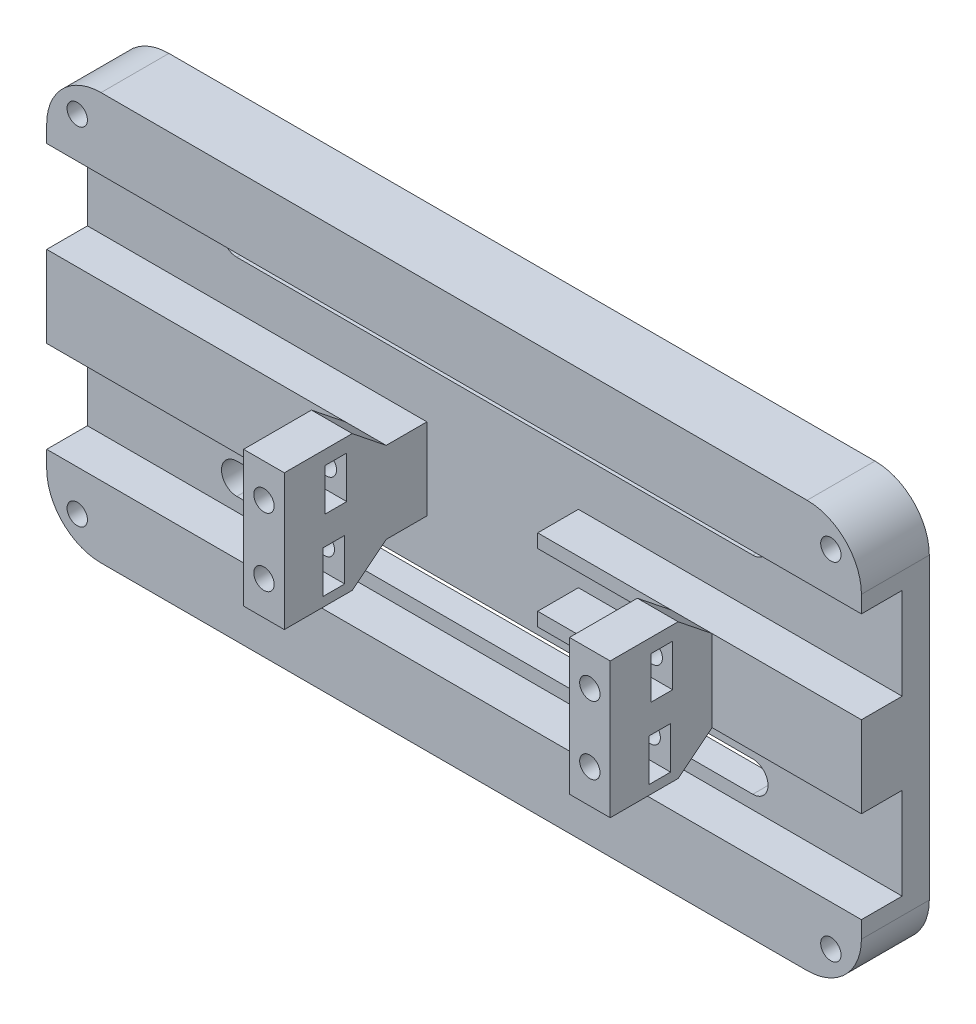
from build123d import *

# Parameters (mm, degrees)
SKETCH1_W             = 120
SKETCH1_H             = 10.5
SKETCH1_R             = 3
BOSS_EXTRUDE1_DEPTH   = 10
SKETCH1_W_2           = 44
SKETCH1_H_2           = 12
BOSS_EXTRUDE1_2_DEPTH = 10
SKETCH1_W_3           = 22
BOSS_EXTRUDE1_3_DEPTH = 10
BOSS_EXTRUDE1_4_DEPTH = 10
SKETCH1_H_3           = 2
BOSS_EXTRUDE1_5_DEPTH = 10
BOSS_EXTRUDE1_6_DEPTH = 10
SKETCH1_5_W           = 6
SKETCH1_5_H           = 20
BOSS_EXTRUDE2_DEPTH   = 25
BOSS_EXTRUDE3_DEPTH   = 4
SKETCH1_8_R           = 3
SKETCH1_8_R_2         = 1.5
BOSS_EXTRUDE4_DEPTH   = 10
SKETCH1_10_R          = 3
SKETCH1_10_R_2        = 1.5
CUT_EXTRUDE1_DEPTH    = 4
SKETCH3_R             = 1.5
CUT_EXTRUDE4_DEPTH    = 14
SKETCH4_R             = 1.5
CUT_EXTRUDE5_DEPTH    = 14
CUT_EXTRUDE6_DEPTH    = 59
SKETCH5_4_W           = 3.2
SKETCH5_4_H           = 6.2
CUT_EXTRUDE8_DEPTH    = 59
SKETCH1_11_R          = 1.5
CUT_EXTRUDE9_DEPTH    = 59
SKETCH6_W             = 2.316345527
SKETCH6_H             = 6
CUT_EXTRUDE10_DEPTH   = 13
FILLET1_R             = 8
SKETCH7_R             = 0.85
CUT_EXTRUDE13_DEPTH   = 6


with BuildPart() as part:
    # Sketch1 → Boss-Extrude1 (new body)
    with BuildSketch(Plane.XY):
        with Locations((0.319715808, 30.75)):
            Rectangle(SKETCH1_W, SKETCH1_H)
        with Locations((-55.180284192, 31.5)):
            Circle(SKETCH1_R, mode=Mode.SUBTRACT)
        with Locations((55.819715808, 31.5)):
            Circle(SKETCH1_R, mode=Mode.SUBTRACT)
    extrude(amount=BOSS_EXTRUDE1_DEPTH)



with BuildPart() as body_2:
    # Sketch1 → Boss-Extrude1 2 (new body)
    with BuildSketch(Plane.XY):
        with Locations((-37.680284192, 6)):
            Rectangle(SKETCH1_W_2, SKETCH1_H_2)
    extrude(amount=BOSS_EXTRUDE1_2_DEPTH)



with BuildPart() as body_3:
    # Sketch1 → Boss-Extrude1 3 (new body)
    with BuildSketch(Plane.XY):
        with Locations((49.319715808, 6)):
            Rectangle(SKETCH1_W_3, SKETCH1_H_2)
    extrude(amount=BOSS_EXTRUDE1_3_DEPTH)


with BuildPart() as body_4:
    # Sketch1 → Boss-Extrude1 4 (new body)
    with BuildSketch(Plane.XY):
        with Locations((0.319715808, -18.75)):
            Rectangle(SKETCH1_W, SKETCH1_H)
        with Locations((-55.180284192, -19.5)):
            Circle(SKETCH1_R, mode=Mode.SUBTRACT)
        with Locations((55.819715808, -19.5)):
            Circle(SKETCH1_R, mode=Mode.SUBTRACT)
    extrude(amount=BOSS_EXTRUDE1_4_DEPTH)


with BuildPart() as body_5:
    # Sketch1 → Boss-Extrude1 5 (new body)
    with BuildSketch(Plane.XY):
        with Locations((21.319715808, 11)):
            Rectangle(SKETCH1_W_3, SKETCH1_H_3)
    extrude(amount=BOSS_EXTRUDE1_5_DEPTH)


with BuildPart() as body_6:
    # Sketch1 → Boss-Extrude1 6 (new body)
    with BuildSketch(Plane.XY):
        with Locations((21.319715808, 1)):
            Rectangle(SKETCH1_W_3, SKETCH1_H_3)
    extrude(amount=BOSS_EXTRUDE1_6_DEPTH)


with BuildPart() as body_2_1:
    add(body_2.part)

    add(body_3.part)  # Boss-Extrude2 merges body 3

    add(body_5.part)  # Boss-Extrude2 merges body 5

    add(body_6.part)  # Boss-Extrude2 merges body 6
    # Sketch1<5> → Boss-Extrude2 (add)
    with BuildSketch(Plane.XY):
        with Locations((-12.680284192, 6)):
            Rectangle(SKETCH1_5_W, SKETCH1_5_H)
        with Locations((35.319715808, 6)):
            Rectangle(SKETCH1_5_W, SKETCH1_5_H)
    extrude(amount=BOSS_EXTRUDE2_DEPTH)


with BuildPart() as part_1:
    add(part.part)

    add(body_2_1.part)  # Boss-Extrude3 merges body 2

    add(body_4.part)  # Boss-Extrude3 merges body 4
    # Sketch1<6> → Boss-Extrude3 (add)
    with BuildSketch(Plane.XY):
        Polygon((60.319715808, 25.5), (-59.680284192, 25.5), (-59.680284192, 12), (-15.680284192, 12), (-15.680284192, 16), (-9.680284192, 16), (-9.680284192, -4), (-15.680284192, -4), (-15.680284192, 0), (-59.680284192, 0), (-59.680284192, -13.5), (60.319715808, -13.5), (60.319715808, 0), (38.319715808, 0), (38.319715808, -4), (32.319715808, -4), (32.319715808, 0), (10.319715808, 0), (10.319715808, 2), (32.319715808, 2), (32.319715808, 10), (10.319715808, 10), (10.319715808, 12), (32.319715808, 12), (32.319715808, 16), (38.319715808, 16), (38.319715808, 12), (60.319715808, 12), align=None)
        with BuildLine():
            ThreePointArc((-37.680284192, 19), (-39.930284192, 21.25), (-37.680284192, 23.5))
            Line((-37.680284192, 23.5), (38.319715808, 23.5))
            ThreePointArc((38.319715808, 23.5), (40.569715808, 21.25), (38.319715808, 19))
            Line((38.319715808, 19), (-37.680284192, 19))
        make_face(mode=Mode.SUBTRACT)
        with BuildLine():
            ThreePointArc((-37.680284192, -11.5), (-39.930284192, -9.25), (-37.680284192, -7))
            Line((-37.680284192, -7), (38.319715808, -7))
            ThreePointArc((38.319715808, -7), (40.569715808, -9.25), (38.319715808, -11.5))
            Line((38.319715808, -11.5), (-37.680284192, -11.5))
        make_face(mode=Mode.SUBTRACT)
    extrude(amount=BOSS_EXTRUDE3_DEPTH)

    # Sketch1<8> → Boss-Extrude4 (add)
    # profile 1 of 4: a face of its own
    with BuildSketch(Plane.XY):
        with Locations((55.819715808, 31.5)):
            Circle(SKETCH1_8_R)
    # profile 2 of 4: a face of its own
    with BuildSketch(Plane.XY):
        with Locations((55.819715808, -19.5)):
            Circle(SKETCH1_8_R)
        with Locations((55.819715808, -19.5)):
            Circle(SKETCH1_8_R_2, mode=Mode.SUBTRACT)
    # profile 3 of 4: a face of its own
    with BuildSketch(Plane.XY):
        with Locations((-55.180284192, 31.5)):
            Circle(SKETCH1_8_R)
        with Locations((-55.180284192, 31.5)):
            Circle(SKETCH1_8_R_2, mode=Mode.SUBTRACT)
    # profile 4 of 4: a face of its own
    with BuildSketch(Plane.XY):
        with Locations((-55.180284192, -19.5)):
            Circle(SKETCH1_8_R)
        with Locations((-55.180284192, -19.5)):
            Circle(SKETCH1_8_R_2, mode=Mode.SUBTRACT)
    extrude(amount=BOSS_EXTRUDE4_DEPTH)

    # Sketch1<10> → Cut-Extrude1 (cut)
    # profile 1 of 4: a face of its own
    with BuildSketch(Plane.XY):
        with Locations((55.819715808, -19.5)):
            Circle(SKETCH1_10_R)
        with Locations((55.819715808, -19.5)):
            Circle(SKETCH1_10_R_2, mode=Mode.SUBTRACT)
    # profile 2 of 4: a face of its own
    with BuildSketch(Plane.XY):
        with Locations((-55.180284192, 31.5)):
            Circle(SKETCH1_10_R)
        with Locations((-55.180284192, 31.5)):
            Circle(SKETCH1_10_R_2, mode=Mode.SUBTRACT)
    # profile 3 of 4: a face of its own
    with BuildSketch(Plane.XY):
        with Locations((-55.180284192, -19.5)):
            Circle(SKETCH1_10_R)
        with Locations((-55.180284192, -19.5)):
            Circle(SKETCH1_10_R_2, mode=Mode.SUBTRACT)
    # profile 4 of 4: a face of its own
    with BuildSketch(Plane.XY):
        with Locations((55.819715808, 31.5)):
            Circle(SKETCH1_10_R)
        with Locations((55.819715808, 31.5)):
            Circle(SKETCH1_10_R_2, mode=Mode.SUBTRACT)
    extrude(amount=CUT_EXTRUDE1_DEPTH, mode=Mode.SUBTRACT)

    # Sketch3 → Cut-Extrude4 (cut)
    with BuildSketch(Plane.XY.offset(25)):
        with Locations((-12.680284192, 11)):
            Circle(SKETCH3_R)
        with Locations((-12.680284192, 1)):
            Circle(SKETCH3_R)
    extrude(amount=-CUT_EXTRUDE4_DEPTH, mode=Mode.SUBTRACT)

    # Sketch4 → Cut-Extrude5 (cut)
    with BuildSketch(Plane.XY.offset(25)):
        with Locations((35.319715808, 10.999295379)):
            Circle(SKETCH4_R)
        with Locations((35.319715808, 0.999295379)):
            Circle(SKETCH4_R)
    extrude(amount=-CUT_EXTRUDE5_DEPTH, mode=Mode.SUBTRACT)

    # Sketch5 → Cut-Extrude6 (cut)
    with BuildSketch(Plane.ZY.offset(15.680284192)):
        Polygon((10, 12), (15, 16), (4, 16), (4, 12), align=None)
        Polygon((4, -4), (15, -4), (10, 0), (4, 0), align=None)
    extrude(amount=-CUT_EXTRUDE6_DEPTH, mode=Mode.SUBTRACT)

    # Sketch5<4> → Cut-Extrude8 (cut)
    with BuildSketch(Plane.ZY.offset(15.680284192)):
        with Locations((17.409200428, 10.831284061)):
            Rectangle(SKETCH5_4_W, SKETCH5_4_H)
        with Locations((17.706989835, 0.475595868)):
            Rectangle(SKETCH5_4_W, SKETCH5_4_H)
    extrude(amount=-CUT_EXTRUDE8_DEPTH, mode=Mode.SUBTRACT)

    # Sketch1<11> → Cut-Extrude9 (cut)
    with BuildSketch(Plane.XY):
        with Locations((55.819715808, 31.5)):
            Circle(SKETCH1_11_R)
    extrude(amount=CUT_EXTRUDE9_DEPTH, mode=Mode.SUBTRACT)

    # Sketch6 → Cut-Extrude10 (cut)
    with BuildSketch(Plane(origin=(0, 0, 0), x_dir=(-1, 0, 0), z_dir=(0, -1, 0))):
        with Locations((-11.477888571, -7)):
            Rectangle(SKETCH6_W, SKETCH6_H)
    extrude(amount=-CUT_EXTRUDE10_DEPTH, mode=Mode.SUBTRACT)

    # Fillet1
    fillet1_edges = [part_1.edges().sort_by_distance(p)[0] for p in [
        (60.319715808, 36, 5),
        (60.319715808, -24, 5),
        (-59.680284192, 36, 5),
        (-59.680284192, -24, 5),
    ]]
    fillet(fillet1_edges, radius=FILLET1_R)

    # Sketch7 → Cut-Extrude13 (cut)
    with BuildSketch(Plane(origin=(0, 0, 0), x_dir=(-1, 0, 0), z_dir=(0, 0, -1))):
        with Locations((51.035618514, 33.268406719)):
            Circle(SKETCH7_R)
        with Locations((45.535618514, 32.990148628)):
            Circle(SKETCH7_R)
        with Locations((56.409164496, 27.113974119)):
            Circle(SKETCH7_R)
        with Locations((-46.279640328, -21.012456623)):
            Circle(SKETCH7_R)
        with Locations((-51.779640328, -21.290714713)):
            Circle(SKETCH7_R)
        with Locations((-57.153186309, -15.136282114)):
            Circle(SKETCH7_R)
        with Locations((45.535618514, 27.113974119)):
            Circle(SKETCH7_R)
        with Locations((-46.279640328, -15.136282114)):
            Circle(SKETCH7_R)
    extrude(amount=-CUT_EXTRUDE13_DEPTH, mode=Mode.SUBTRACT)


solid = part_1.part
